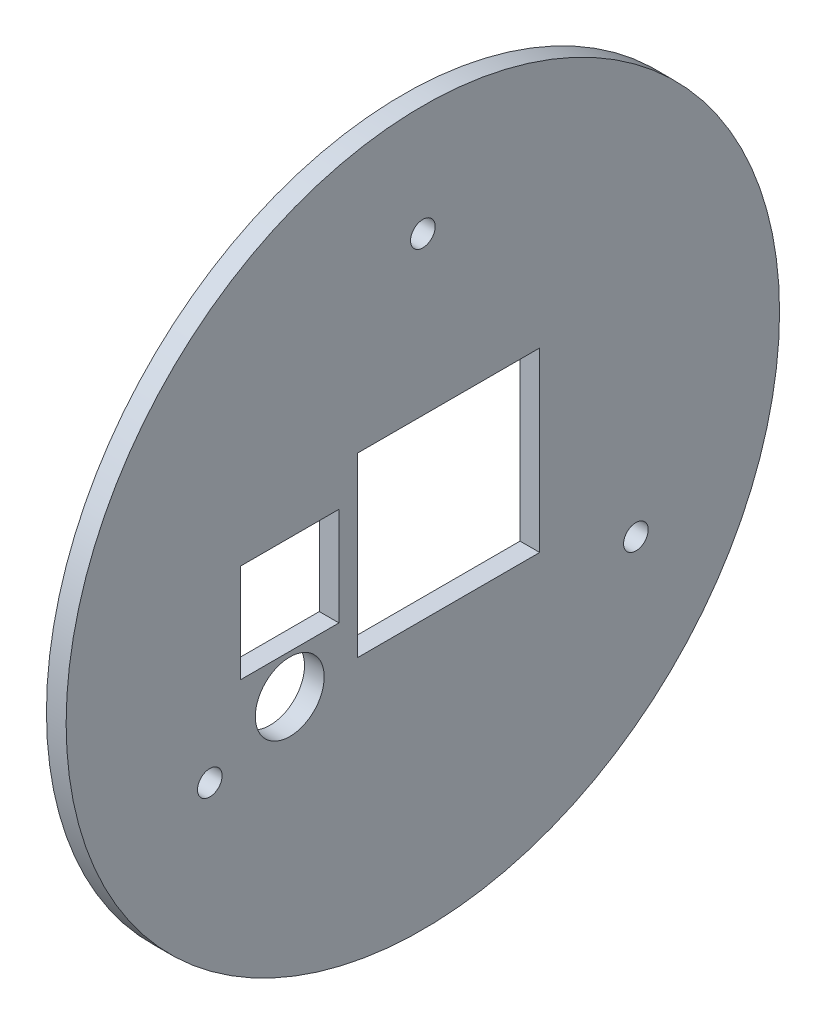
from build123d import *

# Parameters (mm, degrees)
SKETCH1_R           = 72.5
SKETCH1_R_2         = 7
SKETCH1_R_3         = 2.5
SKETCH1_W           = 37
SKETCH1_H           = 36
SKETCH1_W_2         = 20
SKETCH1_H_2         = 20
BOSS_EXTRUDE1_DEPTH = 4


with BuildPart() as part:
    # Sketch1 → Boss-Extrude1 (new body)
    with BuildSketch(Plane(origin=(0, 0, 0), x_dir=(0, 0, -1), z_dir=(1, 0, 0))):
        Circle(SKETCH1_R)
        with Locations((-27.048330148, -18)):
            Circle(SKETCH1_R_2, mode=Mode.SUBTRACT)
        with Locations((0, 50)):
            Circle(SKETCH1_R_3, mode=Mode.SUBTRACT)
        with Locations((43.301270189, -25)):
            Circle(SKETCH1_R_3, mode=Mode.SUBTRACT)
        with Locations((-43.301270189, -25)):
            Circle(SKETCH1_R_3, mode=Mode.SUBTRACT)
        with Locations((5.251669852, 0)):
            Rectangle(SKETCH1_W, SKETCH1_H, mode=Mode.SUBTRACT)
        with Locations((-27.048330148, 0)):
            Rectangle(SKETCH1_W_2, SKETCH1_H_2, mode=Mode.SUBTRACT)
    extrude(amount=BOSS_EXTRUDE1_DEPTH)


solid = part.part
